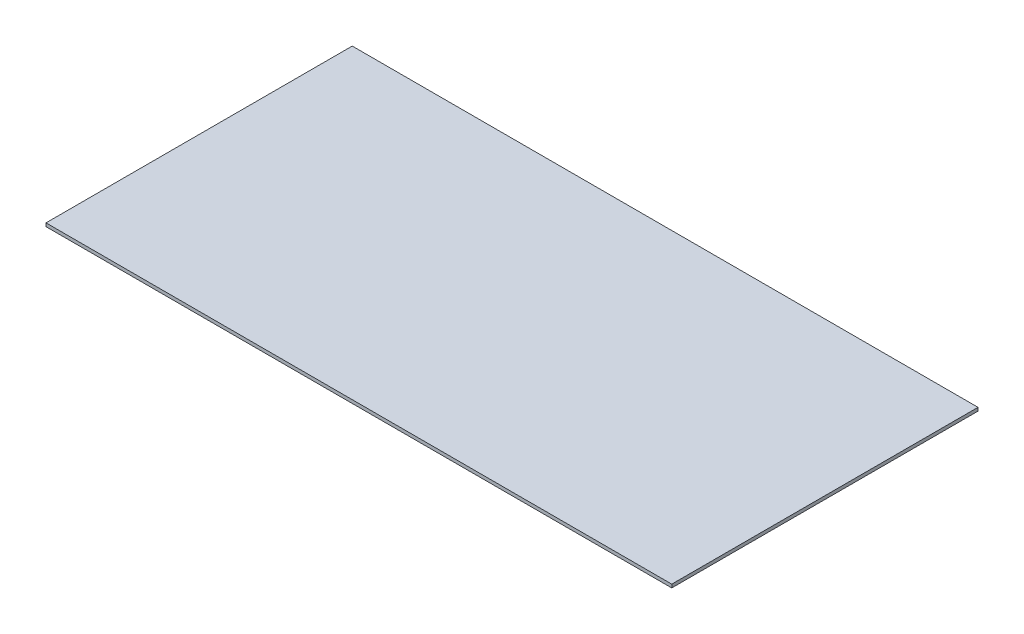
from build123d import *

# Parameters (mm, degrees)
SKETCH1_W           = 566
SKETCH1_H           = 277
BOSS_EXTRUDE1_DEPTH = 3


with BuildPart() as part:
    # Sketch1 → Boss-Extrude1 (new body)
    with BuildSketch(Plane(origin=(0, 0, 0), x_dir=(1, 0, 0), z_dir=(0, 1, 0))):
        with Locations((283, 138.5)):
            Rectangle(SKETCH1_W, SKETCH1_H)
    extrude(amount=BOSS_EXTRUDE1_DEPTH)


solid = part.part
